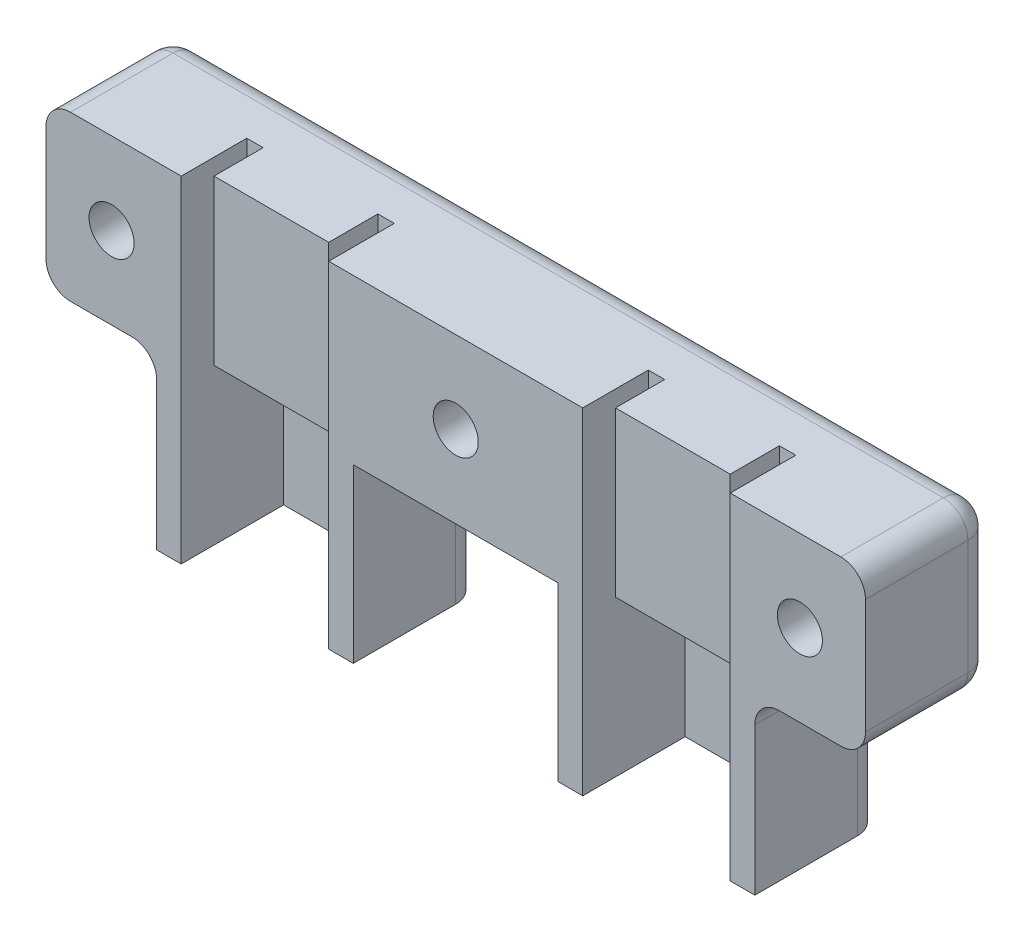
from build123d import *

# Parameters (mm, degrees)
BOSS_EXTRUDE1_DEPTH = 20
EXTRUDE_THIN3_DEPTH = 21
SKETCH3_R           = 2.75
CUT_EXTRUDE1_DEPTH  = 73.35515227
FILLET2_R           = 3
SKETCH4_R           = 1.25
CUT_EXTRUDE2_DEPTH  = 10


with BuildPart() as part:
    # Sketch1 → Boss-Extrude1 (new body)
    with BuildSketch(Plane(origin=(0, 0, 0), x_dir=(1, 0, 0), z_dir=(0, 1, 0))):
        Polygon((-32.516534914, -1.83981797), (-32.516534914, 13.66018203), (67.483465086, 13.66018203), (67.483465086, -1.83981797), (50.983465086, -1.83981797), (50.983465086, 1.63642231), (50.983465086, 6.16018203), (48.983465086, 6.16018203), (48.983465086, 0.16018203), (34.983465086, 0.16018203), (34.983465086, 6.16018203), (32.983465086, 6.16018203), (32.983465086, 1.63642231), (32.983465086, -1.83981797), (1.983465086, -1.83981797), (1.983465086, 1.63642231), (1.983465086, 6.16018203), (-0.016534914, 6.16018203), (-0.016534914, 0.16018203), (-14.016534914, 0.16018203), (-14.016534914, 6.16018203), (-16.016534914, 6.16018203), (-16.016534914, 1.63642231), (-16.016534914, -1.83981797), align=None)
    extrude(amount=BOSS_EXTRUDE1_DEPTH)

    # Sketch2 → Extrude-Thin3 (add)
    with BuildSketch(Plane.XZ):
        Polygon((-19.016534914, 1.83981797), (-19.016534914, -13.66018203), (4.983465086, -13.66018203), (4.983465086, 1.83981797), (1.983465086, 1.83981797), (1.983465086, -10.66018203), (-16.016534914, -10.66018203), (-16.016534914, 1.83981797), align=None)
        Polygon((50.983465086, 1.83981797), (50.983465086, -10.66018203), (32.983465086, -10.66018203), (32.983465086, 1.83981797), (29.983465086, 1.83981797), (29.983465086, -13.66018203), (53.983465086, -13.66018203), (53.983465086, 1.83981797), align=None)
    extrude(amount=EXTRUDE_THIN3_DEPTH)

    # Sketch3 → Cut-Extrude1 (cut, through all)
    with BuildSketch(Plane(origin=(0, 0, -13.66018203), x_dir=(-1, 0, 0), z_dir=(0, 0, -1))):
        with Locations((24.516534914, 10)):
            Circle(SKETCH3_R)
        with Locations((-59.483465086, 10)):
            Circle(SKETCH3_R)
        with Locations((-17.483465086, 10)):
            Circle(SKETCH3_R)
    extrude(amount=-CUT_EXTRUDE1_DEPTH, mode=Mode.SUBTRACT)

    # Fillet2
    fillet2_edges = [part.edges().sort_by_distance(p)[0] for p in [
        (17.483465086, 0, -13.66018203),
        (29.983465086, -10.5, -13.66018203),
        (53.983465086, -10.5, -13.66018203),
        (60.733465086, 0, -13.66018203),
        (67.483465086, 0, -5.91018203),
        (67.483465086, 10, -13.66018203),
        (67.483465086, 20, -5.91018203),
        (17.483465086, 20, -13.66018203),
        (-32.516534914, 20, -5.91018203),
        (-32.516534914, 0, -5.91018203),
        (-19.016534914, 0, -5.91018203),
        (4.983465086, -10.5, -13.66018203),
        (-19.016534914, -10.5, -13.66018203),
        (-25.766534914, 0, -13.66018203),
        (-32.516534914, 10, -13.66018203),
        (53.983465086, 0, -5.91018203),
    ]]
    fillet(fillet2_edges, radius=FILLET2_R)

    # Sketch4 → Cut-Extrude2 (cut)
    with BuildSketch(Plane(origin=(0, 0, -13.66018203), x_dir=(-1, 0, 0), z_dir=(0, 0, -1))):
        with Locations((2.516534914, -9)):
            Circle(SKETCH4_R)
        with Locations((11.516534914, -9)):
            Circle(SKETCH4_R)
    extrude(amount=-CUT_EXTRUDE2_DEPTH, mode=Mode.SUBTRACT)


solid = part.part
